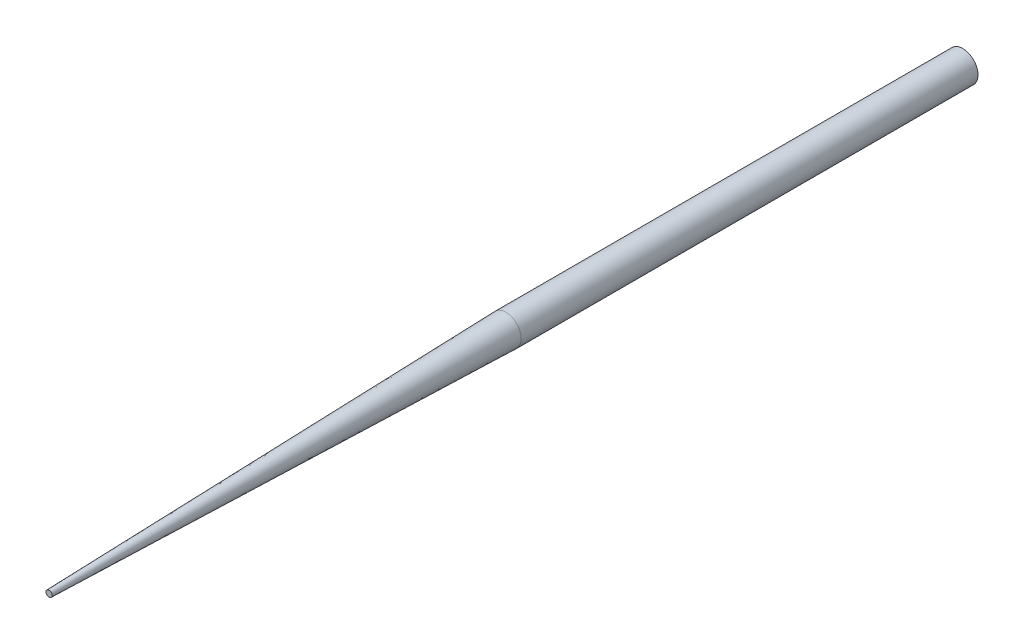
from build123d import *

# Parameters (mm, degrees)
ESQUISSE1_R        = 0.5
BOSS_EXTRU_1_DEPTH = 30
CHANFREIN1_SIZE    = 15
CHANFREIN1_SIZE2   = 0.4


with BuildPart() as part:
    # Esquisse1 → Boss.-Extru.1 (new body)
    with BuildSketch(Plane.XY):
        Circle(ESQUISSE1_R)
    extrude(amount=BOSS_EXTRU_1_DEPTH)

    # Chanfrein1
    chanfrein1_edges = [part.edges().sort_by_distance(p)[0] for p in [
        (-0.5, 0, 30),
    ]]
    chanfrein1_side = [part.faces().sort_by_distance(p)[0] for p in [
        (-0.5, 0, 15),
    ]]
    chamfer(chanfrein1_edges, length=CHANFREIN1_SIZE, length2=CHANFREIN1_SIZE2, reference=chanfrein1_side[0])


solid = part.part
